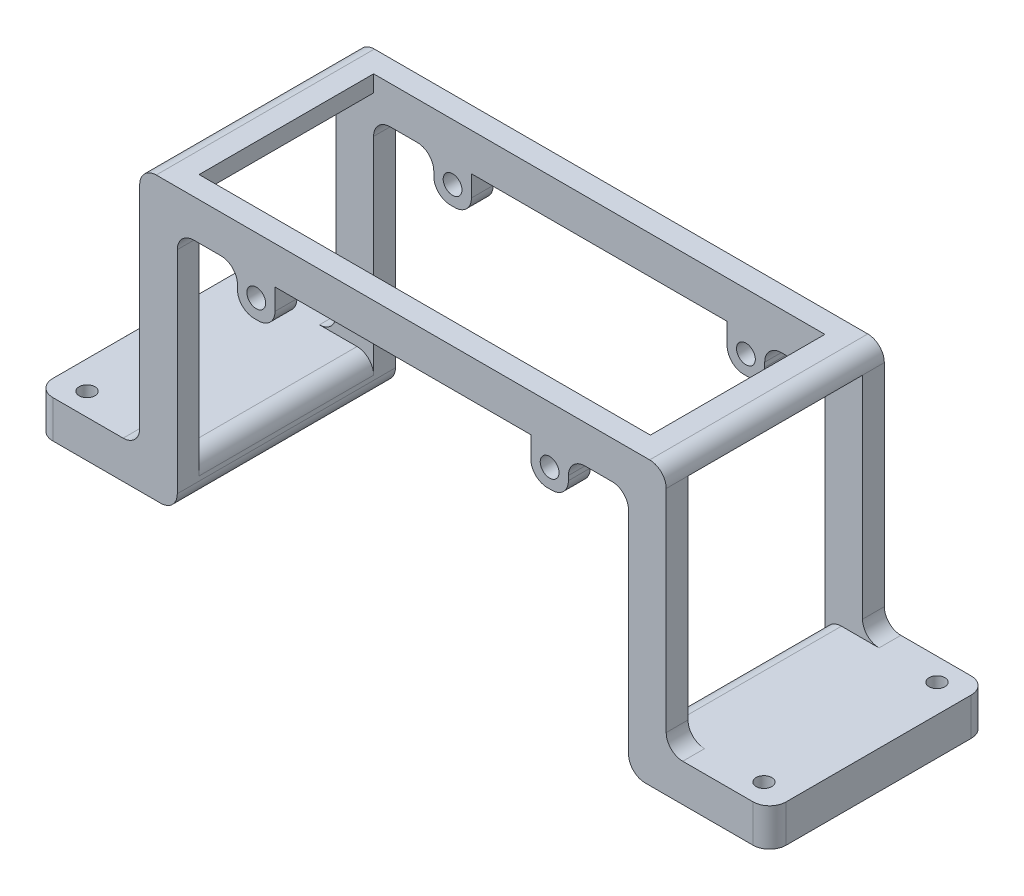
from build123d import *

# Parameters (mm, degrees)
BOSS_EXTRUDE1_START     = -26
SKETCH1_R               = 1.25
BOSS_EXTRUDE1_DEPTH     = 29
SKETCH2_R               = 1.05
CUT_EXTRUDE1_DEPTH      = 65.100019501
FILLET1_R               = 2.2
CUT_EXTRUDE2_DEPTH      = 63.8694083
CUT_EXTRUDE2_DEPTH_BACK = 63.8694083
SKETCH3_W               = 60
SKETCH3_H               = 23.2
CUT_EXTRUDE3_DEPTH      = 63.8694083
CUT_EXTRUDE3_DEPTH_BACK = 63.8694083
SKETCH4_W               = 23.2
SKETCH4_H               = 30.3
FILLET2_R               = 2.2


with BuildPart() as part:
    # Sketch1 → Boss-Extrude1 (new body)
    with BuildSketch(Plane.XY.offset(BOSS_EXTRUDE1_START)):
        Polygon((-30, -30), (-30, 2.5), (-22, 2.5), (-22, -2.5), (-17, -2.5), (-17, 2.5), (0, 2.5), (0, 7.5), (-35, 7.5), (-35, -25), (-48.75, -25), (-48.75, -30), align=None)
        with Locations((-19.5, 0)):
            Circle(SKETCH1_R, mode=Mode.SUBTRACT)
    boss_extrude1 = extrude(amount=BOSS_EXTRUDE1_DEPTH)

    # Sketch2 → Cut-Extrude1 (cut, through all)
    with BuildSketch(Plane(origin=(0, -25, 0), x_dir=(1, 0, 0), z_dir=(0, 1, 0))):
        with Locations(Location((-45, 23, 0), (0, 0, 180))):
            Circle(SKETCH2_R)
        with Locations(Location((-45, 0, 0), (0, 0, 180))):
            Circle(SKETCH2_R)
    cut_extrude1 = extrude(amount=-CUT_EXTRUDE1_DEPTH, mode=Mode.SUBTRACT)

    # Mirror1: Boss-Extrude1, Cut-Extrude1 across plane
    add(boss_extrude1.mirror(Plane(origin=(0, 0, 0), x_dir=(0, 0, 1), z_dir=(1, 0, 0))))
    add(cut_extrude1.mirror(Plane(origin=(0, 0, 0), x_dir=(0, 0, 1), z_dir=(1, 0, 0))), mode=Mode.SUBTRACT)

    # Fillet1
    fillet1_edges = [part.edges().sort_by_distance(p)[0] for p in [
        (-17, -2.5, -11.5),
        (-22, -2.5, -11.5),
        (-22, 2.5, -11.5),
        (-30, 2.5, -11.5),
        (-30, -30, -11.5),
        (-35, -25, -11.5),
        (-35, 7.5, -11.5),
        (-48.75, -27.5, 3),
        (-48.75, -27.5, -26),
        (17, -2.5, -11.5),
        (22, -2.5, -11.5),
        (22, 2.5, -11.5),
        (30, 2.5, -11.5),
        (30, -30, -11.5),
        (48.75, -27.5, -26),
        (48.75, -27.5, 3),
        (35, -25, -11.5),
        (35, 7.5, -11.5),
    ]]
    fillet(fillet1_edges, radius=FILLET1_R)

    # Sketch3 → Cut-Extrude2 (cut, two sides: drawn at the far end of the back side and taken through both)
    with BuildSketch(Plane(origin=(0, 0, 0), x_dir=(1, 0, 0), z_dir=(0, 1, 0)).offset(-CUT_EXTRUDE2_DEPTH_BACK)):
        with Locations((0, 11.5)):
            Rectangle(SKETCH3_W, SKETCH3_H)
    extrude(amount=CUT_EXTRUDE2_DEPTH + CUT_EXTRUDE2_DEPTH_BACK, mode=Mode.SUBTRACT)

    # Sketch4 → Cut-Extrude3 (cut, two sides: drawn at the far end of the back side and taken through both)
    with BuildSketch(Plane(origin=(0, 0, 0), x_dir=(0, 0, -1), z_dir=(1, 0, 0)).offset(-CUT_EXTRUDE3_DEPTH_BACK)):
        with Locations((11.5, -9.85)):
            Rectangle(SKETCH4_W, SKETCH4_H)
    extrude(amount=CUT_EXTRUDE3_DEPTH + CUT_EXTRUDE3_DEPTH_BACK, mode=Mode.SUBTRACT)

    # Fillet2
    fillet2_edges = [part.edges().sort_by_distance(p)[0] for p in [
        (-30, -25, -11.5),
        (30, -25, -11.5),
    ]]
    fillet(fillet2_edges, radius=FILLET2_R)


solid = part.part
